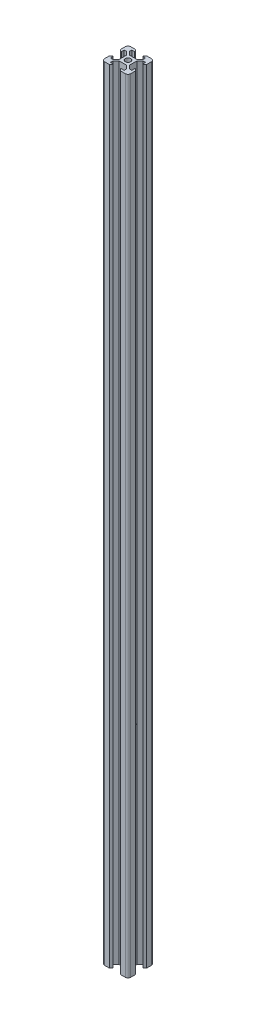
from build123d import *

# Parameters (mm, degrees)
CROQUIS1_R              = 2.1
SALIENTE_EXTRUIR2_DEPTH = 600
CROQUIS2_R              = 2.1
CORTAR_EXTRUIR2_DEPTH   = 175


with BuildPart() as part:
    # Croquis1 → Saliente-Extruir2 (new body)
    with BuildSketch(Plane(origin=(0, 0, 0), x_dir=(1, 0, 0), z_dir=(0, 1, 0))):
        with BuildLine():
            Line((3.9, -2.84), (3.9, 2.84))
            Line((3.9, 2.84), (6.36, 5.3))
            Line((6.36, 5.3), (8.2, 5.3))
            Line((8.2, 5.3), (8.2, 3.34))
            ThreePointArc((8.2, 3.34), (8.346446609, 2.986446609), (8.7, 2.84))
            Line((8.7, 2.84), (10, 4.14))
            Line((10, 4.14), (10, 8))
            ThreePointArc((10, 8), (9.414213562, 9.414213562), (8, 10))
            Line((8, 10), (4.14, 10))
            Line((4.14, 10), (2.84, 8.7))
            ThreePointArc((2.84, 8.7), (2.986446609, 8.346446609), (3.34, 8.2))
            Line((3.34, 8.2), (5.3, 8.2))
            Line((5.3, 8.2), (5.3, 6.36))
            Line((5.3, 6.36), (2.84, 3.9))
            Line((2.84, 3.9), (-2.84, 3.9))
            Line((-2.84, 3.9), (-5.3, 6.36))
            Line((-5.3, 6.36), (-5.3, 8.2))
            Line((-5.3, 8.2), (-3.34, 8.2))
            ThreePointArc((-3.34, 8.2), (-2.986446609, 8.346446609), (-2.84, 8.7))
            Line((-2.84, 8.7), (-4.14, 10))
            Line((-4.14, 10), (-8, 10))
            ThreePointArc((-8, 10), (-9.414213562, 9.414213562), (-10, 8))
            Line((-10, 8), (-10, 4.14))
            Line((-10, 4.14), (-8.7, 2.84))
            ThreePointArc((-8.7, 2.84), (-8.346446609, 2.986446609), (-8.2, 3.34))
            Line((-8.2, 3.34), (-8.2, 5.3))
            Line((-8.2, 5.3), (-6.36, 5.3))
            Line((-6.36, 5.3), (-3.9, 2.84))
            Line((-3.9, 2.84), (-3.9, -2.84))
            Line((-3.9, -2.84), (-6.36, -5.3))
            Line((-6.36, -5.3), (-8.2, -5.3))
            Line((-8.2, -5.3), (-8.2, -3.34))
            ThreePointArc((-8.2, -3.34), (-8.346446609, -2.986446609), (-8.7, -2.84))
            Line((-8.7, -2.84), (-10, -4.14))
            Line((-10, -4.14), (-10, -8))
            ThreePointArc((-10, -8), (-9.414213562, -9.414213562), (-8, -10))
            Line((-8, -10), (-4.14, -10))
            Line((-4.14, -10), (-2.84, -8.7))
            ThreePointArc((-2.84, -8.7), (-2.986446609, -8.346446609), (-3.34, -8.2))
            Line((-3.34, -8.2), (-5.3, -8.2))
            Line((-5.3, -8.2), (-5.3, -6.36))
            Line((-5.3, -6.36), (-2.84, -3.9))
            Line((-2.84, -3.9), (2.84, -3.9))
            Line((2.84, -3.9), (5.3, -6.36))
            Line((5.3, -6.36), (5.3, -8.2))
            Line((5.3, -8.2), (3.34, -8.2))
            ThreePointArc((3.34, -8.2), (2.986446609, -8.346446609), (2.84, -8.7))
            Line((2.84, -8.7), (4.14, -10))
            Line((4.14, -10), (8, -10))
            ThreePointArc((8, -10), (9.414213562, -9.414213562), (10, -8))
            Line((10, -8), (10, -4.14))
            Line((10, -4.14), (8.7, -2.84))
            ThreePointArc((8.7, -2.84), (8.346446609, -2.986446609), (8.2, -3.34))
            Line((8.2, -3.34), (8.2, -5.3))
            Line((8.2, -5.3), (6.36, -5.3))
            Line((6.36, -5.3), (3.9, -2.84))
        make_face()
        with Locations(Location((0, 0, 0), (0, 0, 270))):
            Circle(CROQUIS1_R, mode=Mode.SUBTRACT)
    extrude(amount=SALIENTE_EXTRUIR2_DEPTH)

    # Croquis2 → Cortar-Extruir2 (cut, symmetric)
    with BuildSketch(Plane(origin=(0, 0, 0), x_dir=(0, 0, -1), z_dir=(1, 0, 0))):
        with Locations((0, 160)):
            Circle(CROQUIS2_R)
    extrude(amount=CORTAR_EXTRUIR2_DEPTH, both=True, mode=Mode.SUBTRACT)


solid = part.part
